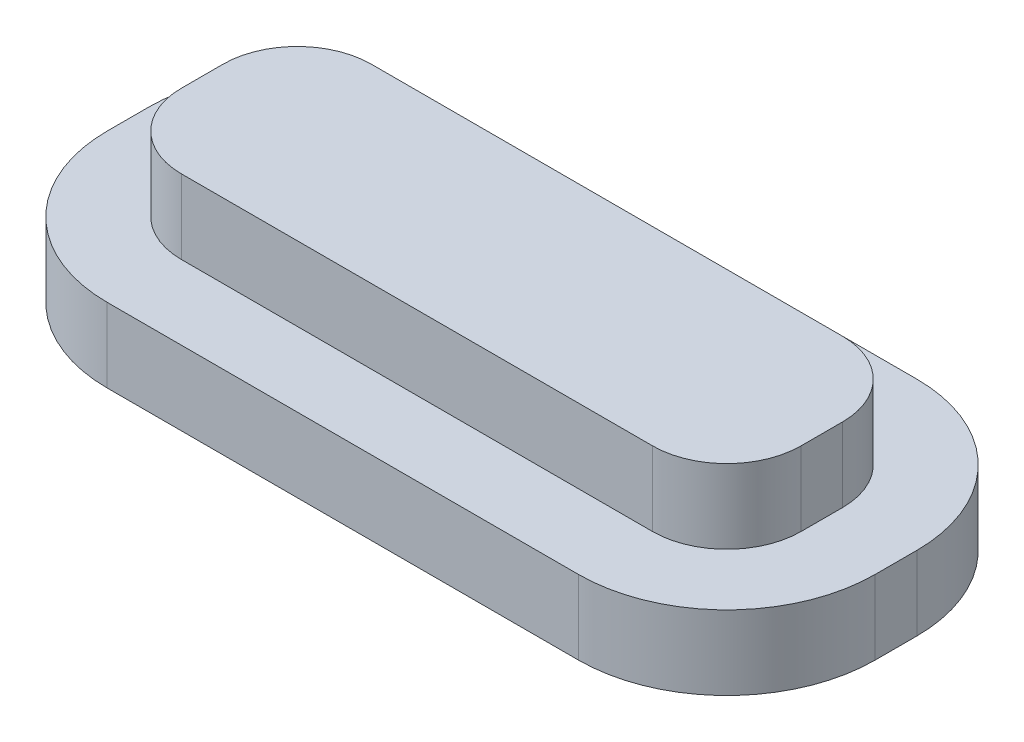
from build123d import *

# Parameters (mm, degrees)
BOSS_EXTRUDE1_DEPTH = 1
BOSS_EXTRUDE2_DEPTH = 2


with BuildPart() as part:
    # Sketch1 → Boss-Extrude1 (new body)
    with BuildSketch(Plane(origin=(0, 0, 0), x_dir=(1, 0, 0), z_dir=(0, 1, 0))):
        with BuildLine():
            Line((-3.175, 2.28), (3.175, 2.28))
            ThreePointArc((3.175, 2.28), (4.589213562, 1.694213562), (5.175, 0.28))
            Line((5.175, 0.28), (5.175, -0.28))
            ThreePointArc((5.175, -0.28), (4.589213562, -1.694213562), (3.175, -2.28))
            Line((3.175, -2.28), (-3.175, -2.28))
            ThreePointArc((-3.175, -2.28), (-4.589213562, -1.694213562), (-5.175, -0.28))
            Line((-5.175, -0.28), (-5.175, 0.28))
            ThreePointArc((-5.175, 0.28), (-4.589213562, 1.694213562), (-3.175, 2.28))
        make_face()
        with BuildLine():
            Line((-3.175, -1.28), (3.175, -1.28))
            ThreePointArc((3.175, -1.28), (3.882106781, -0.987106781), (4.175, -0.28))
            Line((4.175, -0.28), (4.175, 0.28))
            ThreePointArc((4.175, 0.28), (3.882106781, 0.987106781), (3.175, 1.28))
            Line((3.175, 1.28), (-3.175, 1.28))
            ThreePointArc((-3.175, 1.28), (-3.882106781, 0.987106781), (-4.175, 0.28))
            Line((-4.175, 0.28), (-4.175, -0.28))
            ThreePointArc((-4.175, -0.28), (-3.882106781, -0.987106781), (-3.175, -1.28))
        make_face(mode=Mode.SUBTRACT)
    extrude(amount=BOSS_EXTRUDE1_DEPTH)

    # Sketch1<2> → Boss-Extrude2 (add)
    with BuildSketch(Plane(origin=(0, 0, 0), x_dir=(1, 0, 0), z_dir=(0, 1, 0))):
        with BuildLine():
            ThreePointArc((-4.175, -0.28), (-3.882106781, -0.987106781), (-3.175, -1.28))
            Line((-3.175, -1.28), (3.175, -1.28))
            ThreePointArc((3.175, -1.28), (3.882106781, -0.987106781), (4.175, -0.28))
            Line((4.175, -0.28), (4.175, 0.28))
            ThreePointArc((4.175, 0.28), (3.882106781, 0.987106781), (3.175, 1.28))
            Line((3.175, 1.28), (-3.175, 1.28))
            ThreePointArc((-3.175, 1.28), (-3.882106781, 0.987106781), (-4.175, 0.28))
            Line((-4.175, 0.28), (-4.175, -0.28))
        make_face()
    extrude(amount=BOSS_EXTRUDE2_DEPTH)


solid = part.part
